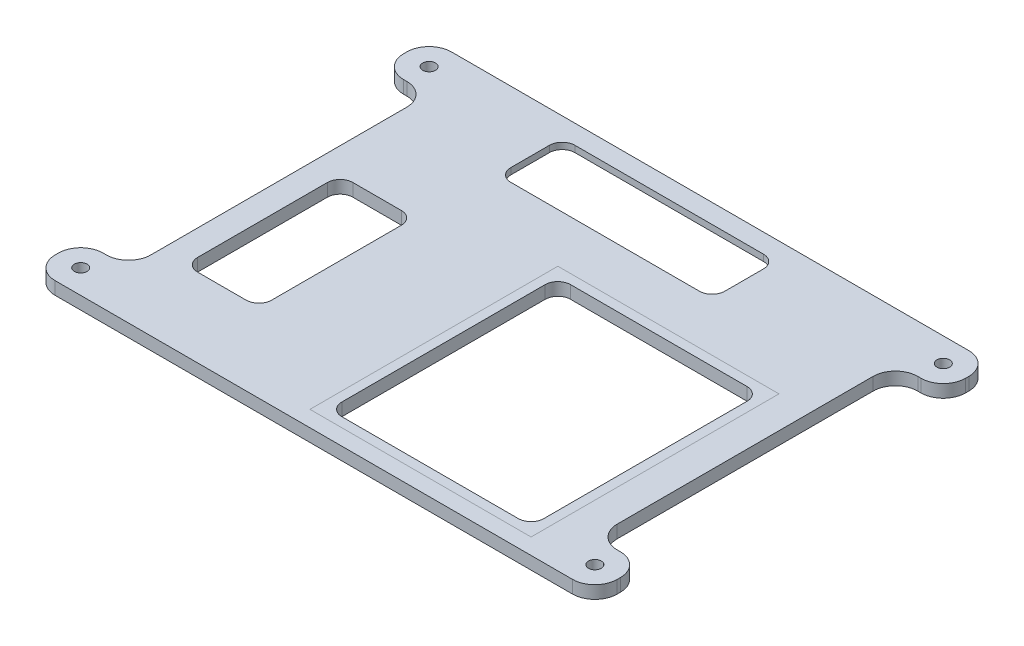
from build123d import *

# Parameters (mm, degrees)
SKETCH1_W               = 164.15
SKETCH1_H               = 135.2
SKETCH1_W_2             = 69.3
SKETCH1_H_2             = 77.7
SKETCH1_W_3             = 71.1
SKETCH1_H_3             = 24.1
SKETCH1_W_4             = 15.2
SKETCH1_H_4             = 40.66
BOSS_EXTRUDE1_DEPTH     = 4
SKETCH3_W               = 75.1
SKETCH3_H               = 28.1
SKETCH3_W_2             = 67.1
SKETCH3_H_2             = 20.1
EXTRUDE_THIN1_DEPTH     = 2
SKETCH4_W               = 23.2
SKETCH4_H               = 48.66
SKETCH4_W_2             = 15.2
SKETCH4_H_2             = 40.66
CUT_EXTRUDE_THIN1_DEPTH = 10
CUT_EXTRUDE4_DEPTH      = 4
FILLET3_R               = 4
SKETCH9_W               = 15
SKETCH9_H               = 15
SKETCH9_R               = 2
BOSS_EXTRUDE5_DEPTH     = 4
FILLET4_R               = 7
SKETCH10_W              = 69.3
SKETCH10_H              = 77.7
SKETCH10_W_2            = 63.3
SKETCH10_H_2            = 71.7
EXTRUDE_THIN2_DEPTH     = 4
FILLET5_R               = 4


with BuildPart() as part:
    # Sketch1 → Boss-Extrude1 (new body)
    with BuildSketch(Plane(origin=(0, 0, 0), x_dir=(1, 0, 0), z_dir=(0, 1, 0))):
        with Locations((-62.075, 57.6)):
            Rectangle(SKETCH1_W, SKETCH1_H)
        with Locations((-34.65, 38.85)):
            Rectangle(SKETCH1_W_2, SKETCH1_H_2, mode=Mode.SUBTRACT)
        with Locations((-69.9, 103.15)):
            Rectangle(SKETCH1_W_3, SKETCH1_H_3, mode=Mode.SUBTRACT)
        with Locations((-116.55, 43.97)):
            Rectangle(SKETCH1_W_4, SKETCH1_H_4, mode=Mode.SUBTRACT)
    extrude(amount=BOSS_EXTRUDE1_DEPTH)

    # Sketch3 → Extrude-Thin1 (add)
    with BuildSketch(Plane(origin=(0, 4, 0), x_dir=(1, 0, 0), z_dir=(0, 1, 0))):
        with Locations((-69.9, 103.15)):
            Rectangle(SKETCH3_W, SKETCH3_H)
        with Locations((-69.9, 103.15)):
            Rectangle(SKETCH3_W_2, SKETCH3_H_2, mode=Mode.SUBTRACT)
    extrude(amount=-EXTRUDE_THIN1_DEPTH)

    # Sketch4 → Cut-Extrude-Thin1 (cut)
    with BuildSketch(Plane(origin=(0, 4, 0), x_dir=(1, 0, 0), z_dir=(0, 1, 0))):
        with Locations((-116.55, 43.97)):
            Rectangle(SKETCH4_W, SKETCH4_H)
        with Locations((-116.55, 43.97)):
            Rectangle(SKETCH4_W_2, SKETCH4_H_2, mode=Mode.SUBTRACT)
    extrude(amount=-CUT_EXTRUDE_THIN1_DEPTH, mode=Mode.SUBTRACT)

    # Sketch8 → Cut-Extrude4 (cut)
    with BuildSketch(Plane(origin=(0, 4, 0), x_dir=(1, 0, 0), z_dir=(0, 1, 0))):
        Polygon((-136.15, 119.2), (-144.15, 119.2), (-144.15, -5), (-136.15, -5), (-136.15, 68.3), align=None)
        Polygon((20, -5), (20, 119.2), (10, 119.2), (10, 77.7), (10, -5), align=None)
        Polygon((-136.15, -5), (-144.15, -5), (-144.15, -10), (20, -10), (20, -5), (10, -5), align=None)
        Polygon((20, 125.2), (-144.15, 125.2), (-144.15, 119.2), (-136.15, 119.2), (10, 119.2), (20, 119.2), align=None)
    extrude(amount=-CUT_EXTRUDE4_DEPTH, mode=Mode.SUBTRACT)

    # Fillet3
    fillet3_edges = [part.edges().sort_by_distance(p)[0] for p in [
        (-103.45, 3, -113.2),
        (-36.35, 3, -113.2),
        (-36.35, 3, -93.1),
        (-103.45, 3, -93.1),
        (-128.15, 2, -19.64),
        (-128.15, 2, -68.3),
        (-104.95, 2, -68.3),
        (-104.95, 2, -19.64),
    ]]
    fillet(fillet3_edges, radius=FILLET3_R)

    # Sketch9 → Boss-Extrude5 (add)
    # profile 1 of 4: a face of its own
    with BuildSketch(Plane(origin=(0, 4, 0), x_dir=(1, 0, 0), z_dir=(0, 1, 0))):
        with Locations((-143.65, 111.7)):
            Rectangle(SKETCH9_W, SKETCH9_H)
        with Locations(Location((-143.65, 111.7, 0), (0, 0, 270))):
            Circle(SKETCH9_R, mode=Mode.SUBTRACT)
    # profile 2 of 4: a face of its own
    with BuildSketch(Plane(origin=(0, 4, 0), x_dir=(1, 0, 0), z_dir=(0, 1, 0))):
        with Locations((17.5, 111.7)):
            Rectangle(SKETCH9_W, SKETCH9_H)
        with Locations(Location((17.5, 111.7, 0), (0, 0, 90))):
            Circle(SKETCH9_R, mode=Mode.SUBTRACT)
    # profile 3 of 4: a face of its own
    with BuildSketch(Plane(origin=(0, 4, 0), x_dir=(1, 0, 0), z_dir=(0, 1, 0))):
        with Locations((17.5, 2.5)):
            Rectangle(SKETCH9_W, SKETCH9_H)
        with Locations(Location((17.5, 2.5, 0), (0, 0, 270))):
            Circle(SKETCH9_R, mode=Mode.SUBTRACT)
    # profile 4 of 4: a face of its own
    with BuildSketch(Plane(origin=(0, 4, 0), x_dir=(1, 0, 0), z_dir=(0, 1, 0))):
        with Locations((-143.65, 2.5)):
            Rectangle(SKETCH9_W, SKETCH9_H)
        with Locations(Location((-143.65, 2.5, 0), (0, 0, 90))):
            Circle(SKETCH9_R, mode=Mode.SUBTRACT)
    extrude(amount=-BOSS_EXTRUDE5_DEPTH)

    # Fillet4
    fillet4_edges = [part.edges().sort_by_distance(p)[0] for p in [
        (-136.15, 2, -104.2),
        (-151.15, 2, -104.2),
        (-151.15, 2, -119.2),
        (25, 2, -119.2),
        (25, 2, -104.2),
        (10, 2, -104.2),
        (10, 2, -10),
        (25, 2, -10),
        (25, 2, 5),
        (-151.15, 2, 5),
        (-151.15, 2, -10),
        (-136.15, 2, -10),
    ]]
    fillet(fillet4_edges, radius=FILLET4_R)


with BuildPart() as body_2:
    # Sketch10 → Extrude-Thin2 (new body)
    with BuildSketch(Plane(origin=(0, 4, 0), x_dir=(1, 0, 0), z_dir=(0, 1, 0))):
        with Locations((-34.65, 38.85)):
            Rectangle(SKETCH10_W, SKETCH10_H)
        with Locations((-34.65, 38.85)):
            Rectangle(SKETCH10_W_2, SKETCH10_H_2, mode=Mode.SUBTRACT)
    extrude(amount=-EXTRUDE_THIN2_DEPTH)

    # Fillet5
    fillet5_edges = [body_2.edges().sort_by_distance(p)[0] for p in [
        (-66.3, 2, -3),
        (-66.3, 2, -74.7),
        (-3, 2, -74.7),
        (-3, 2, -3),
    ]]
    fillet(fillet5_edges, radius=FILLET5_R)


solid = Compound([part.part, body_2.part])
